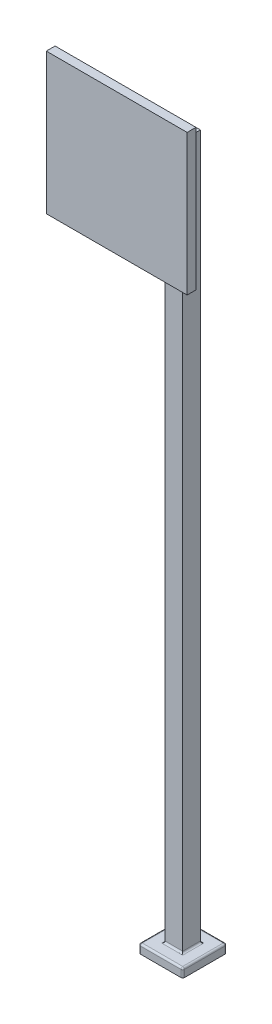
from build123d import *

# Parameters (mm, degrees)
SKETCH1_W           = 100
SKETCH1_H           = 4000
BOSS_EXTRUDE1_DEPTH = 50
SKETCH2_W           = 250
SKETCH2_H           = 250
BOSS_EXTRUDE2_DEPTH = 50
SKETCH3_W           = 400
SKETCH3_H           = 50
BOSS_EXTRUDE3_DEPTH = 25
SKETCH4_W           = 800
SKETCH4_H           = 800
BOSS_EXTRUDE4_DEPTH = 25
FILLET1_R           = 10
FILLET3_R           = 10
FILLET4_R           = 10


with BuildPart() as part:
    # Sketch1 → Boss-Extrude1 (new, symmetric)
    with BuildSketch(Plane.XY):
        with Locations((0, 2000)):
            Rectangle(SKETCH1_W, SKETCH1_H)
    extrude(amount=BOSS_EXTRUDE1_DEPTH, both=True)

    # Sketch2 → Boss-Extrude2 (add)
    with BuildSketch(Plane(origin=(0, 0, 0), x_dir=(1, 0, 0), z_dir=(0, 1, 0))):
        Rectangle(SKETCH2_W, SKETCH2_H)
    extrude(amount=-BOSS_EXTRUDE2_DEPTH)

    # Sketch3 → Boss-Extrude3 (add, symmetric)
    with BuildSketch(Plane(origin=(0, 0, 0), x_dir=(0, 0, -1), z_dir=(1, 0, 0))):
        with Locations((-150, 3975)):
            Rectangle(SKETCH3_W, SKETCH3_H)
    extrude(amount=BOSS_EXTRUDE3_DEPTH, both=True)

    # Sketch4 → Boss-Extrude4 (add, symmetric)
    with BuildSketch(Plane.XY.offset(350)):
        with Locations((0, 3975)):
            Rectangle(SKETCH4_W, SKETCH4_H)
    extrude(amount=BOSS_EXTRUDE4_DEPTH, both=True)

    # Fillet1
    fillet1_edges = [part.edges().sort_by_distance(p)[0] for p in [
        (125, -25, -125),
        (125, -25, 125),
        (-125, -25, 125),
        (-125, -25, -125),
        (125, 0, 0),
        (0, 0, -125),
        (-125, 0, 0),
        (0, 0, 125),
        (0, 0, -50),
        (50, 0, 0),
        (-50, 0, 0),
        (0, 0, 50),
    ]]
    fillet(fillet1_edges, radius=FILLET1_R)

    # Fillet3
    fillet3_edges = [part.edges().sort_by_distance(p)[0] for p in [
        (25, 3975, 50),
        (-25, 3975, 50),
        (25, 3975, 325),
        (-25, 3975, 325),
    ]]
    fillet(fillet3_edges, radius=FILLET3_R)

    # Fillet4
    fillet4_edges = [part.edges().sort_by_distance(p)[0] for p in [
        (0, 3950, 325),
        (0, 4000, 325),
    ]]
    fillet(fillet4_edges, radius=FILLET4_R)


solid = part.part
